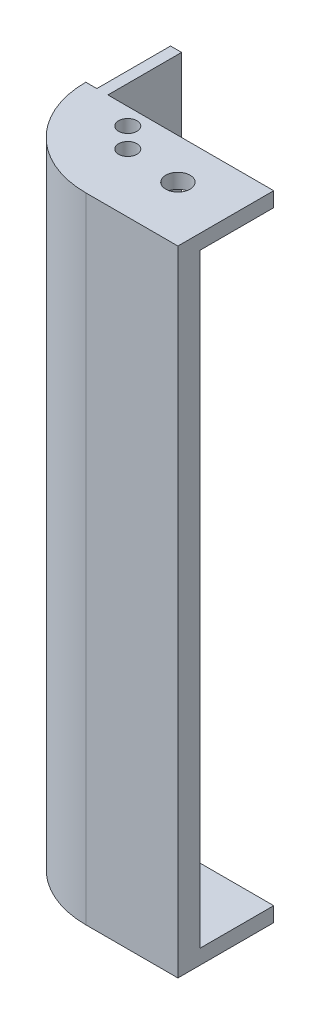
from build123d import *

# Parameters (mm, degrees)
SKETCH_1_W                  = 30
SKETCH_1_H                  = 11
EXTRUDE_1_DEPTH             = 6
SKETCH_2_W                  = 16
SKETCH_2_H                  = 2
CUT_EXTRUDE_1_DEPTH         = 144
EXTRUDE_2_DEPTH             = 80
SKETCH_4_R                  = 1.75
CUT_EXTRUDE_2_DEPTH         = 144
SKETCH_5_W                  = 11
SKETCH_5_H                  = 86
CUT_EXTRUDE_3_DEPTH         = 2.5
EXTRUDE_3_REACH             = 83.58
EXTRUDE_3_DIRECTION_2_REACH = 83.58
SKETCH_7_W                  = 1.5
SKETCH_7_H                  = 86
EXTRUDE_4_DEPTH             = 10
CUT_EXTRUDE_4_DEPTH         = 40
EXTRUDE_5_DEPTH             = 2
SKETCH_10_R                 = 1.25
CUT_EXTRUDE_5_DEPTH         = 3
SKETCH_11_W                 = 3
SKETCH_11_H                 = 86
EXTRUDE_6_DEPTH             = 12.5
SKETCH_12_W                 = 10
SKETCH_12_H                 = 2
EXTRUDE_7_DEPTH             = 12.5
SKETCH_13_R                 = 1.65
CUT_EXTRUDE_6_DEPTH         = 100


with BuildPart() as part:
    # 草图1 → 凸台-拉伸1 (new body)
    with BuildSketch(Plane(origin=(0, 0, 0), x_dir=(1, 0, 0), z_dir=(0, 1, 0))):
        Rectangle(SKETCH_1_W, SKETCH_1_H)
    extrude(amount=EXTRUDE_1_DEPTH)

    # 草图2 → 切除-拉伸1 (cut)
    with BuildSketch(Plane.ZY.offset(15)):
        with Locations((-5.5, 3)):
            Rectangle(SKETCH_2_W, SKETCH_2_H)
    extrude(amount=-CUT_EXTRUDE_1_DEPTH, mode=Mode.SUBTRACT)

    # 草图3 → 凸台-拉伸2 (add)
    with BuildSketch(Plane(origin=(0, 6, 0), x_dir=(1, 0, 0), z_dir=(0, 1, 0))):
        Polygon((2, 5.5), (-2, 5.5), (-2, -3.5), (-15, -3.5), (-15, -5.5), (15, -5.5), (15, -3.5), (2, -3.5), align=None)
    extrude(amount=EXTRUDE_2_DEPTH)

    # 草图4 → 切除-拉伸2 (cut)
    with BuildSketch(Plane(origin=(0, 6, 0), x_dir=(1, 0, 0), z_dir=(0, 1, 0))):
        with Locations(Location((-7.5, 2, 0), (0, 0, 270))):
            Circle(SKETCH_4_R)
        with Locations(Location((7.5, 2, 0), (0, 0, 270))):
            Circle(SKETCH_4_R)
    extrude(amount=-CUT_EXTRUDE_2_DEPTH, mode=Mode.SUBTRACT)

    # 草图5 → 切除-拉伸3 (cut)
    with BuildSketch(Plane.ZY.offset(15)):
        with Locations((0, 43)):
            Rectangle(SKETCH_5_W, SKETCH_5_H)
    extrude(amount=-CUT_EXTRUDE_3_DEPTH, mode=Mode.SUBTRACT)

    # 凸台-拉伸3: up to this face of the body (flat: up to its plane)
    extrude_3_end = Plane(part.part.faces().sort_by_distance((0.755494505, 86, 2.324175824))[0])
    # 草图6 → 凸台-拉伸3 (add, up to the picked face)
    with BuildSketch(Plane(origin=(0, 6, 0), x_dir=(1, 0, 0), z_dir=(0, 1, 0)), mode=Mode.PRIVATE) as extrude_3_sk1:
        with BuildLine():
            Line((-22.5, 7.5), (-25.5, 7.5))
            ThreePointArc((-25.5, 7.5), (-21.692388155, -1.692388155), (-12.5, -5.5))
            Line((-12.5, -5.5), (-12.5, -2.5))
            ThreePointArc((-12.5, -2.5), (-19.571067812, 0.428932188), (-22.5, 7.5))
        make_face()
    extrude_3_tool1 = split(extrude(extrude_3_sk1.sketch, amount=EXTRUDE_3_REACH, mode=Mode.PRIVATE), bisect_by=extrude_3_end, keep=Keep.BOTH, mode=Mode.PRIVATE)
    add(extrude_3_tool1.solids().sort_by(Axis((-19.862646, 6, -0.137354), (0, 1, 0)))[0])

    # 凸台-拉伸3 direction 2: up to this face of the body (flat: up to its plane)
    extrude_3_direction_2_end = Plane(part.part.faces().sort_by_distance((1.334914955, 0, 0.135863928))[0])
    # 草图6 → 凸台-拉伸3 direction 2 (add, up to the picked face)
    with BuildSketch(Plane(origin=(0, 6, 0), x_dir=(1, 0, 0), z_dir=(0, 1, 0)), mode=Mode.PRIVATE) as extrude_3_direction_2_sk1:
        with BuildLine():
            Line((-22.5, 7.5), (-25.5, 7.5))
            ThreePointArc((-25.5, 7.5), (-21.692388155, -1.692388155), (-12.5, -5.5))
            Line((-12.5, -5.5), (-12.5, -2.5))
            ThreePointArc((-12.5, -2.5), (-19.571067812, 0.428932188), (-22.5, 7.5))
        make_face()
    extrude_3_direction_2_tool1 = split(extrude(extrude_3_direction_2_sk1.sketch, amount=-EXTRUDE_3_DIRECTION_2_REACH, mode=Mode.PRIVATE), bisect_by=extrude_3_direction_2_end, keep=Keep.BOTH, mode=Mode.PRIVATE)
    add(extrude_3_direction_2_tool1.solids().sort_by(Axis((-19.862646, 6, -0.137354), (0, -1, 0)))[0])

    # 草图7 → 凸台-拉伸4 (add)
    with BuildSketch(Plane(origin=(0, 0, -7.5), x_dir=(-1, 0, 0), z_dir=(0, 0, -1))):
        with Locations((23.25, 43)):
            Rectangle(SKETCH_7_W, SKETCH_7_H)
    extrude(amount=EXTRUDE_4_DEPTH)

    # 草图8 → 切除-拉伸4 (cut)
    with BuildSketch(Plane(origin=(-12.5, 0, 0), x_dir=(0, 0, -1), z_dir=(1, 0, 0))):
        Polygon((26.892505746, 86), (-2.5, 86), (-2.5, 6), (-2.5, -9.514717226), (26.892505746, -9.514717226), align=None)
        Polygon((-3.5, 6), (-3.5, 86), (-26.700940199, 86), (-26.700940199, -9.514717226), (-2.5, -9.514717226), (-2.5, 6), align=None)
    extrude(amount=CUT_EXTRUDE_4_DEPTH, mode=Mode.SUBTRACT)


with BuildPart() as cut_extrude_4_kept_piece:
    # of the separate pieces the step leaves, the one the design keeps (cut_extrude_4_pieces_kept)
    add(part.part.solids().sort_by_distance((-22.5, 0, -7.5))[0])

    # 草图9 → 凸台-拉伸5 (add)
    with BuildSketch(Plane(origin=(0, 86, 0), x_dir=(1, 0, 0), z_dir=(0, 1, 0))):
        with BuildLine():
            Line((-12.5, -2.5), (-12.5, 7.5))
            Line((-12.5, 7.5), (-22.5, 7.5))
            ThreePointArc((-22.5, 7.5), (-19.571067812, 0.428932188), (-12.5, -2.5))
        make_face()
    extrude_5 = extrude(amount=-EXTRUDE_5_DEPTH)

    # 草图10 → 切除-拉伸5 (cut)
    with BuildSketch(Plane(origin=(0, 84, 0), x_dir=(-1, 0, 0), z_dir=(0, -1, 0))):
        with Locations(Location((14.8, 2.5, 0), (0, 0, 90))):
            Circle(SKETCH_10_R)
        with Locations(Location((17.5, 5.2, 0), (0, 0, 90))):
            Circle(SKETCH_10_R)
    cut_extrude_5 = extrude(amount=-CUT_EXTRUDE_5_DEPTH, mode=Mode.SUBTRACT)

    # 镜向2: 凸台-拉伸5, 切除-拉伸5 across plane
    add(extrude_5.mirror(Plane(origin=(0, 43, 0), x_dir=(0, 0, 1), z_dir=(0, -1, 0))))
    add(cut_extrude_5.mirror(Plane(origin=(0, 43, 0), x_dir=(0, 0, 1), z_dir=(0, -1, 0))), mode=Mode.SUBTRACT)

    # 草图11 → 凸台-拉伸6 (add)
    with BuildSketch(Plane(origin=(-12.5, 0, 0), x_dir=(0, 0, -1), z_dir=(1, 0, 0))):
        with Locations((-4, 43)):
            Rectangle(SKETCH_11_W, SKETCH_11_H)
    extrude(amount=EXTRUDE_6_DEPTH)

    # 草图12 → 凸台-拉伸7 (add)
    with BuildSketch(Plane(origin=(-12.5, 0, 0), x_dir=(0, 0, -1), z_dir=(1, 0, 0))):
        with Locations((2.5, 1)):
            Rectangle(SKETCH_12_W, SKETCH_12_H)
        with Locations((2.5, 85)):
            Rectangle(SKETCH_12_W, SKETCH_12_H)
    extrude(amount=EXTRUDE_7_DEPTH)

    # 草图13 → 切除-拉伸6 (cut)
    with BuildSketch(Plane(origin=(0, 86, 0), x_dir=(1, 0, 0), z_dir=(0, 1, 0))):
        with Locations(Location((-7.5, 2, 0), (0, 0, 270))):
            Circle(SKETCH_13_R)
    extrude(amount=-CUT_EXTRUDE_6_DEPTH, mode=Mode.SUBTRACT)


solid = cut_extrude_4_kept_piece.part
